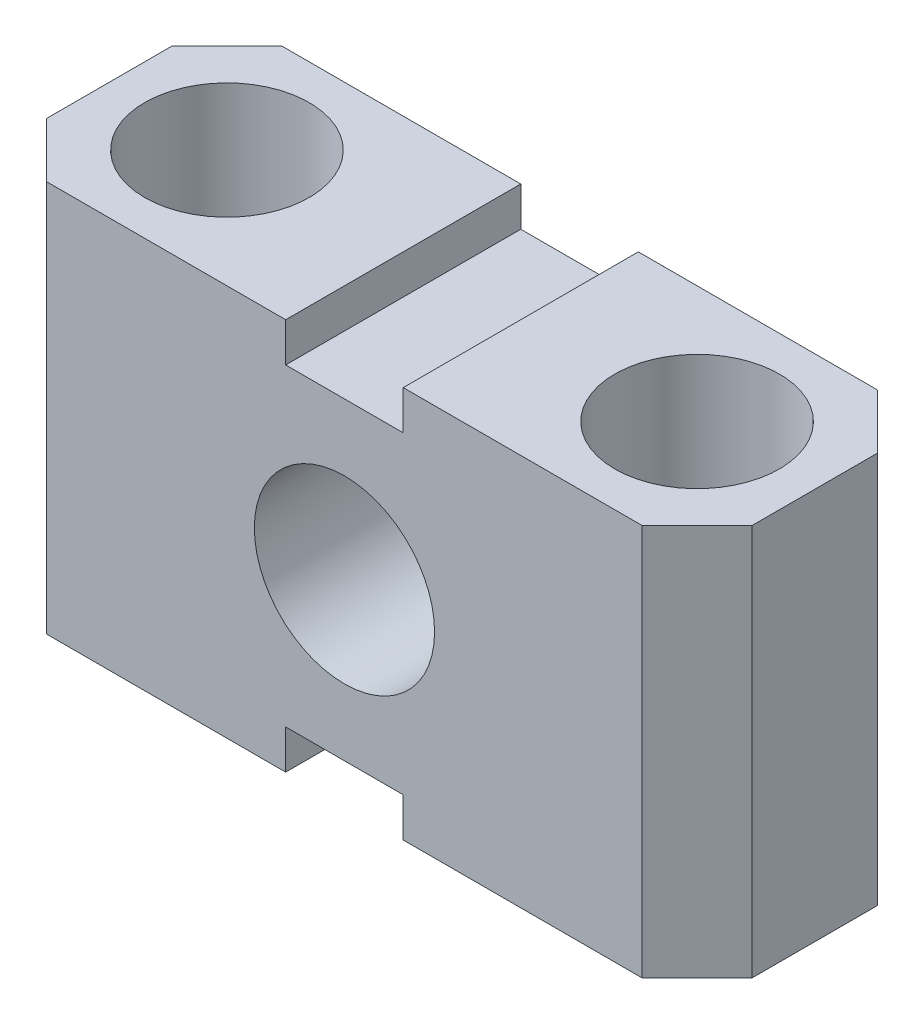
from build123d import *

# Parameters (mm, degrees)
SKETCH_1_W          = 90
SKETCH_1_H          = 50
EXTRUDE_1_DEPTH     = 30
SKETCH_3_R          = 10.5
CUT_EXTRUDE_2_DEPTH = 108.238052948
CHAMFER_1_SIZE      = 7
SKETCH_8_R          = 18
CUT_EXTRUDE_5_DEPTH = 2
SKETCH_7_R          = 11.5
CUT_EXTRUDE_6_DEPTH = 120
SKETCH_12_W         = 15
SKETCH_12_H         = 5
CUT_EXTRUDE_8_DEPTH = 70


with BuildPart() as part:
    # 草图1 → 拉伸1 (new body)
    with BuildSketch(Plane.XY):
        with Locations((45, -25)):
            Rectangle(SKETCH_1_W, SKETCH_1_H)
    extrude(amount=EXTRUDE_1_DEPTH)

    # 草图3 → 切除-拉伸2 (cut, through all)
    with BuildSketch(Plane(origin=(0, 0, 0), x_dir=(1, 0, 0), z_dir=(0, 1, 0))):
        with Locations(Location((15, -15, 0), (0, 0, 270))):
            Circle(SKETCH_3_R)
        with Locations(Location((75, -15, 0), (0, 0, 270))):
            Circle(SKETCH_3_R)
    extrude(amount=-CUT_EXTRUDE_2_DEPTH, mode=Mode.SUBTRACT)

    # 倒角1
    chamfer_1_edges = [part.edges().sort_by_distance(p)[0] for p in [
        (90, -25, 30),
        (0, -25, 30),
        (90, -25, 0),
        (0, -25, 0),
    ]]
    chamfer(chamfer_1_edges, length=CHAMFER_1_SIZE)

    # 草图8 → 切除-拉伸5 (cut)
    with BuildSketch(Plane(origin=(0, 0, 0), x_dir=(-1, 0, 0), z_dir=(0, 0, -1))):
        with Locations((-45, -25)):
            Circle(SKETCH_8_R)
    extrude(amount=-CUT_EXTRUDE_5_DEPTH, mode=Mode.SUBTRACT)

    # 草图7 → 切除-拉伸6 (cut)
    with BuildSketch(Plane.XY.offset(30)):
        with Locations((45, -25)):
            Circle(SKETCH_7_R)
    extrude(amount=-CUT_EXTRUDE_6_DEPTH, mode=Mode.SUBTRACT)

    # 草图12 → 切除-拉伸8 (cut)
    with BuildSketch(Plane(origin=(0, 0, 0), x_dir=(-1, 0, 0), z_dir=(0, 0, -1))):
        with Locations((-45, -2.5)):
            Rectangle(SKETCH_12_W, SKETCH_12_H)
        with Locations((-45, -47.5)):
            Rectangle(SKETCH_12_W, SKETCH_12_H)
    extrude(amount=-CUT_EXTRUDE_8_DEPTH, mode=Mode.SUBTRACT)


solid = part.part
